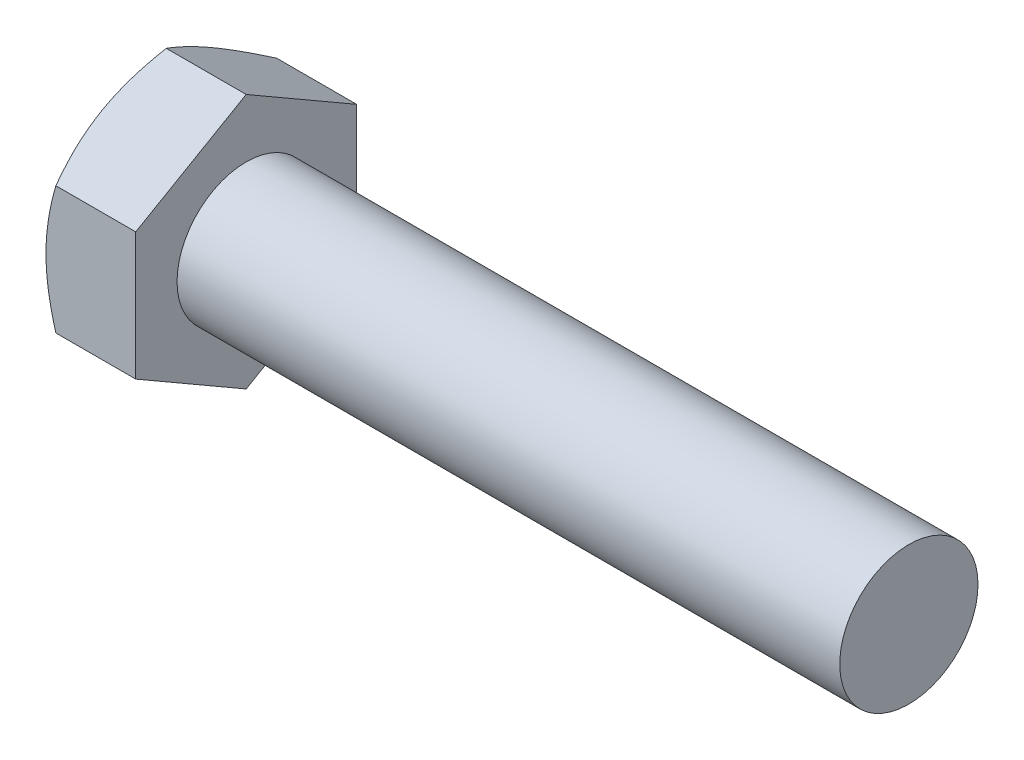
from build123d import *

# Parameters (mm, degrees)
SKETCH5_R           = 3.9751
BOSS_EXTRUDE3_DEPTH = 38.1
BOSS_EXTRUDE4_DEPTH = 5.159375
SKETCH8_OUTSIDE_W   = 181.222
SKETCH8_OUTSIDE_H   = 183.186
SKETCH8_OUTSIDE_R   = 6.35
CUT_EXTRUDE3_DEPTH  = 45.333501539
CUT_EXTRUDE3_DRAFT  = -60


with BuildPart() as part:
    # Sketch5 → Boss-Extrude3 (new body)
    with BuildSketch(Plane(origin=(21.6296875, 0, 0), x_dir=(0, 0, -1), z_dir=(1, 0, 0))):
        Circle(SKETCH5_R)
    extrude(amount=-BOSS_EXTRUDE3_DEPTH)

    # Sketch6 → Boss-Extrude4 (add)
    with BuildSketch(Plane.ZY.offset(16.4703125)):
        Polygon((6.35, 3.666174209), (0, 7.332348419), (-6.35, 3.666174209), (-6.35, -3.666174209), (0, -7.332348419), (6.35, -3.666174209), align=None)
    extrude(amount=BOSS_EXTRUDE4_DEPTH)


with BuildPart() as cut_extrude3_tool:
    # Sketch8 outside → Cut-Extrude3 (with draft: the straight prism first)
    with BuildSketch(Plane.ZY.offset(21.6296875)):
        Rectangle(SKETCH8_OUTSIDE_W, SKETCH8_OUTSIDE_H)
        Circle(SKETCH8_OUTSIDE_R, mode=Mode.SUBTRACT)
    extrude(amount=-CUT_EXTRUDE3_DEPTH)
    # Cut-Extrude3: the draft: its side faces are tilted about the plane it starts from
    cut_extrude3_sides = [cut_extrude3_tool.faces().sort_by_distance(p)[0] for p in [
        (1.03706327, -91.593, 0),
        (1.03706327, 0, 90.611),
        (1.03706327, 91.593, 0),
        (1.03706327, 0, -90.611),
        (1.03706327, 0, -6.35),
    ]]
    draft(cut_extrude3_sides, Plane.ZY.offset(21.6296875), CUT_EXTRUDE3_DRAFT)


with BuildPart() as part_1:
    add(part.part)

    # Cut-Extrude3: cut by cut_extrude3_tool
    add(cut_extrude3_tool.part, mode=Mode.SUBTRACT)


solid = part_1.part
